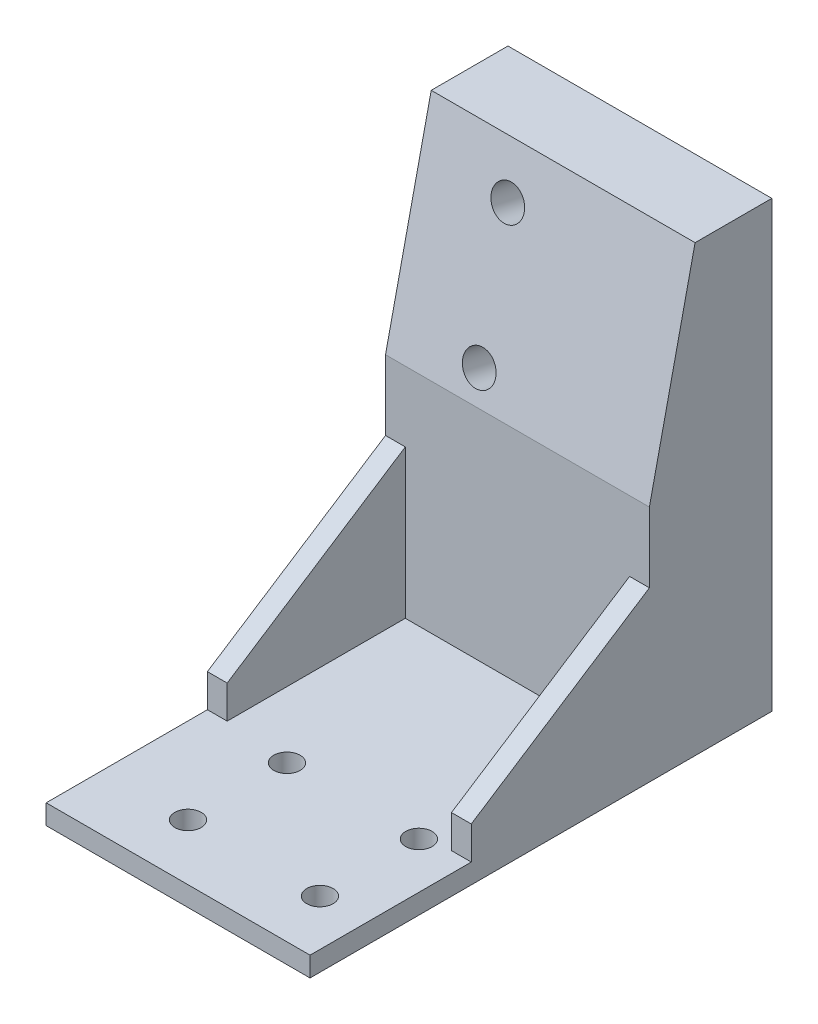
from build123d import *

# Parameters (mm, degrees)
SKETCH_1_W          = 40
SKETCH_1_H          = 70
EXTRUDE_1_DEPTH     = 3
SKETCH_4_R          = 2
CUT_EXTRUDE_1_DEPTH = 41.422765863
EXTRUDE_2_DEPTH     = 40
SKETCH_6_R          = 2.5
CUT_EXTRUDE_2_DEPTH = 84.85628385
EXTRUDE_3_DEPTH     = 3


with BuildPart() as part:
    # 草图1 → 凸台-拉伸1 (new body)
    with BuildSketch(Plane(origin=(0, 0, 0), x_dir=(1, 0, 0), z_dir=(0, 1, 0))):
        Rectangle(SKETCH_1_W, SKETCH_1_H)
    extrude(amount=EXTRUDE_1_DEPTH)

    # 草图4 → 切除-拉伸1 (cut, through all)
    with BuildSketch(Plane(origin=(0, 3, 0), x_dir=(1, 0, 0), z_dir=(0, 1, 0))):
        with Locations(Location((-7, -11.5, 0), (0, 0, 270))):
            Circle(SKETCH_4_R)
        with Locations(Location((13, -11.5, 0), (0, 0, 270))):
            Circle(SKETCH_4_R)
        with Locations(Location((-7, -26.5, 0), (0, 0, 270))):
            Circle(SKETCH_4_R)
        with Locations(Location((13, -26.5, 0), (0, 0, 270))):
            Circle(SKETCH_4_R)
    extrude(amount=-CUT_EXTRUDE_1_DEPTH, mode=Mode.SUBTRACT)

    # 草图5 → 凸台-拉伸2 (add)
    with BuildSketch(Plane(origin=(20, 0, 0), x_dir=(0, 0, -1), z_dir=(1, 0, 0))):
        Polygon((16.44, 3), (16.44, 36.11), (23.366067646, 67.351472228), (35, 67.351472228), (35, 3), align=None)
    extrude(amount=-EXTRUDE_2_DEPTH)

    # 草图6 → 切除-拉伸2 (cut, through all)
    with BuildSketch(Plane(origin=(0, -1.782309206, -8.039477294), x_dir=(1, 0, 0), z_dir=(0, 0.21643961393810343, 0.9762960071199333))):
        with Locations(Location((-6.77, 63.31231607, 0), (0, 0, 270))):
            Circle(SKETCH_6_R)
        with Locations(Location((-6.77, 43.31231607, 0), (0, 0, 270))):
            Circle(SKETCH_6_R)
    extrude(amount=-CUT_EXTRUDE_2_DEPTH, mode=Mode.SUBTRACT)

    # 草图7 → 凸台-拉伸3 (add)
    with BuildSketch(Plane(origin=(20, 0, 0), x_dir=(0, 0, -1), z_dir=(1, 0, 0))):
        Polygon((16.44, 25.5), (-10.56, 8), (-10.56, 3), (16.44, 3), align=None)
    extrude_3 = extrude(amount=-EXTRUDE_3_DEPTH)

    # 镜向1: 凸台-拉伸3 across plane
    add(extrude_3.mirror(Plane(origin=(0, 0, 0), x_dir=(0, 0, 1), z_dir=(1, 0, 0))))


solid = part.part
